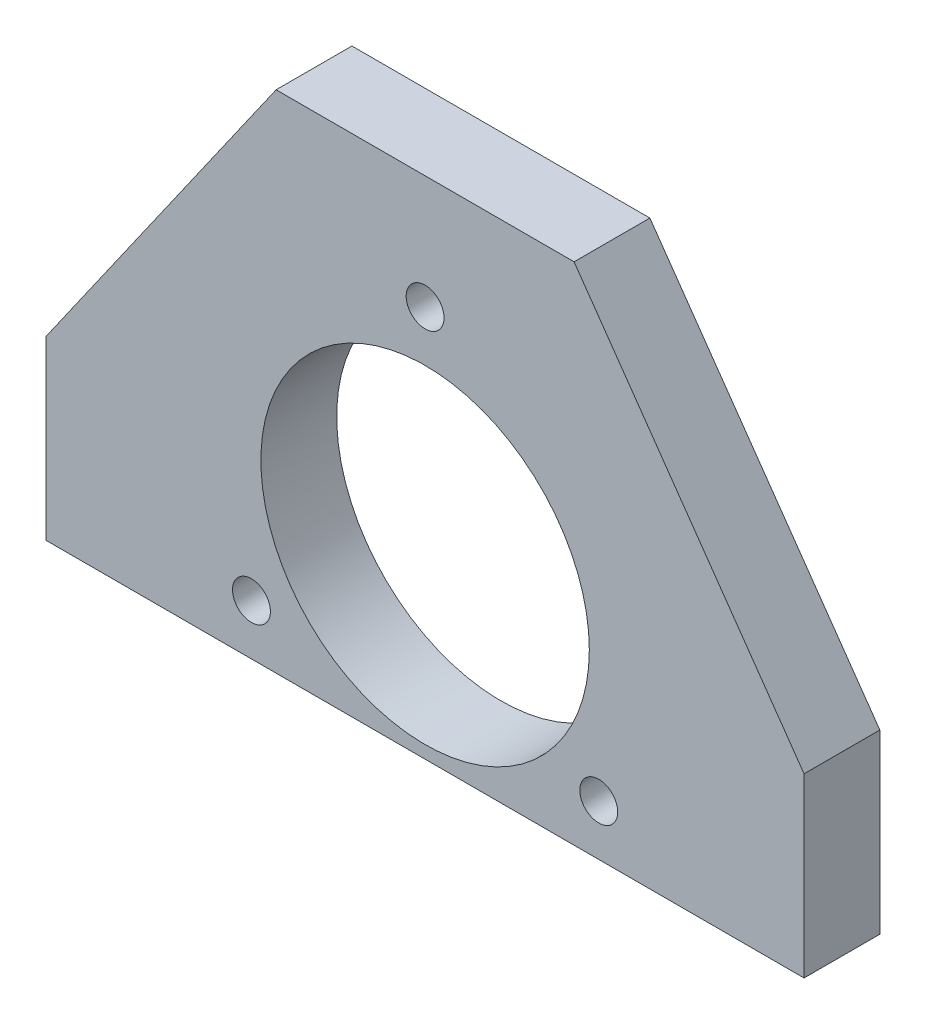
from build123d import *

# Parameters (mm, degrees)
ESQUISSE1_R             = 13
BOSS_EXTRU_1_DEPTH      = 6
ESQUISSE2_R             = 1.5
ENL_V_MAT_EXTRU_1_DEPTH = 10


with BuildPart() as part:
    # Esquisse1 → Boss.-Extru.1 (new body)
    with BuildSketch(Plane.XY):
        Polygon((41.794604007, 40), (60, 14), (60, 0), (0, 0), (0, 14), (18.205395993, 40), align=None)
        with Locations((30, 14)):
            Circle(ESQUISSE1_R, mode=Mode.SUBTRACT)
    extrude(amount=BOSS_EXTRU_1_DEPTH)

    # Esquisse2 → Enlèv. mat.-Extru.1 (cut)
    with BuildSketch(Plane.XY.offset(6)):
        with Locations((16.252272915, 4)):
            Circle(ESQUISSE2_R)
        with Locations((43.747727085, 4)):
            Circle(ESQUISSE2_R)
        with Locations((30, 31)):
            Circle(ESQUISSE2_R)
    extrude(amount=-ENL_V_MAT_EXTRU_1_DEPTH, mode=Mode.SUBTRACT)


solid = part.part
